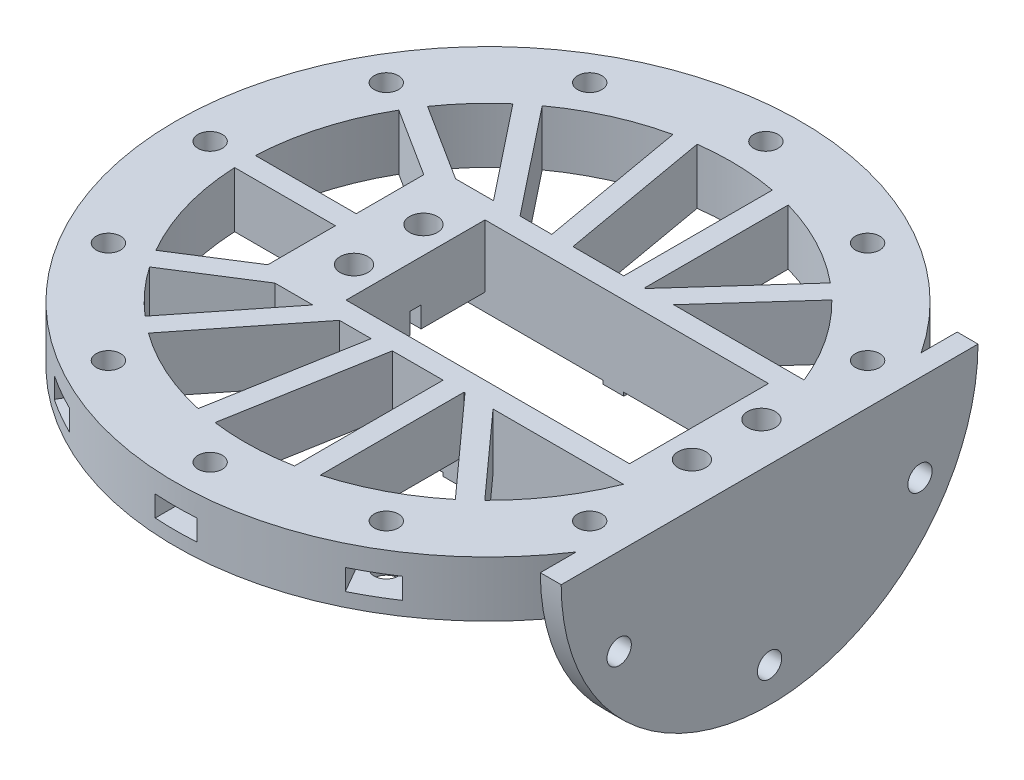
from build123d import *
from build123d.topology import SkipClean

# Parameters (mm, degrees)
SKETCH1_R                      = 45
BOSS_EXTRUDE1_DEPTH            = 12
SKETCH2_R                      = 35
CUT_EXTRUDE1_DEPTH             = 0.5
SKETCH3_W                      = 55
SKETCH3_H                      = 20
CUT_EXTRUDE2_DEPTH             = 2.5
CUT_EXTRUDE2_DIRECTION_2_REACH = 66.67
SKETCH4_W                      = 40.8
SKETCH4_H                      = 20
CUT_EXTRUDE3_DEPTH             = 9
BOSS_EXTRUDE2_DEPTH            = 0.5
SKETCH16_W                     = 7.160198966
SKETCH16_H                     = 1.6
SKETCH16_W_2                   = 7.039801034
CUT_EXTRUDE10_DEPTH            = 3
SKETCH27_R                     = 1.75
CUT_EXTRUDE15_DEPTH            = 65.761099435
CUT_EXTRUDE17_START            = -3
CUT_EXTRUDE17_DEPTH            = 3
SKETCH32_R                     = 2
CUT_EXTRUDE21_DEPTH            = 65.272855857
CUT_EXTRUDE22_DEPTH            = 12
SKETCH33_W                     = 9.501658327
SKETCH33_H                     = 76.019440946
CUT_EXTRUDE24_DEPTH            = 65.761099435
BOSS_EXTRUDE3_DEPTH            = 3
SKETCH35_W                     = 37
SKETCH35_H                     = 4
CUT_EXTRUDE26_DEPTH            = 90
CUT_EXTRUDE27_DEPTH            = 67.136223055
CUT_EXTRUDE27_DEPTH_BACK       = 67.136223055
CUT_EXTRUDE28_REACH            = 100.31
SKETCH37_R                     = 1.75


with BuildPart() as part:
    # Sketch1 → Boss-Extrude1 (new body)
    with BuildSketch(Plane(origin=(0, 0, 0), x_dir=(1, 0, 0), z_dir=(0, 1, 0))):
        with Locations(Location((0, 0, 0), (0, 0, 270))):
            Circle(SKETCH1_R)
    extrude(amount=BOSS_EXTRUDE1_DEPTH)

    # Sketch2 → Cut-Extrude1 (cut)
    with BuildSketch(Plane.XZ):
        with Locations(Location((0, 0, 0), (0, 0, 270))):
            Circle(SKETCH2_R)
    extrude(amount=-CUT_EXTRUDE1_DEPTH, mode=Mode.SUBTRACT)

    # Sketch3 → Cut-Extrude2 (cut)
    with BuildSketch(Plane.XZ.offset(-0.5)):
        with Locations((10.032407403, 0)):
            Rectangle(SKETCH3_W, SKETCH3_H)
    extrude(amount=-CUT_EXTRUDE2_DEPTH, mode=Mode.SUBTRACT)

    # Sketch3 → Cut-Extrude2 direction 2 (cut, up to next)
    with BuildSketch(Plane.XZ.offset(-0.5), mode=Mode.PRIVATE) as cut_extrude2_direction_2_sk1:
        with Locations((10.032407403, 0)):
            Rectangle(SKETCH3_W, SKETCH3_H)
    cut_extrude2_direction_2_tool1 = extrude(cut_extrude2_direction_2_sk1.sketch, amount=CUT_EXTRUDE2_DIRECTION_2_REACH, mode=Mode.PRIVATE) & part.part
    add(cut_extrude2_direction_2_tool1.solids().sort_by_distance((10.032407, 0.5, 0))[0], mode=Mode.SUBTRACT)

    # Sketch4 → Cut-Extrude3 (cut)
    with BuildSketch(Plane.XZ.offset(-3)):
        with Locations((9.972208437, 0)):
            Rectangle(SKETCH4_W, SKETCH4_H)
    extrude(amount=-CUT_EXTRUDE3_DEPTH, mode=Mode.SUBTRACT)

    # Sketch8 → Boss-Extrude2 (add, through all)
    with BuildSketch(Plane.XZ.offset(-0.5)):
        with BuildLine():
            Line((6.536713533, 10), (6.536713533, 34.384173339))
            ThreePointArc((6.536713533, 34.384173339), (8.317046002, 35.216938381), (9.536713533, 33.675675123))
            Line((9.536713533, 33.675675123), (9.536713533, 10))
            Line((9.536713533, 10), (6.536713533, 10))
        make_face()
        with BuildLine():
            Line((9.536713533, -10), (6.536713533, -10))
            Line((6.536713533, -10), (6.536713533, -34.384173339))
            ThreePointArc((6.536713533, -34.384173339), (8.317046002, -35.216938381), (9.536713533, -33.675675123))
            Line((9.536713533, -33.675675123), (9.536713533, -10))
        make_face()
        with BuildLine():
            Line((-17.467592597, 1.5), (-34.96784237, 1.5))
            ThreePointArc((-34.96784237, 1.5), (-36.46784237, 0), (-34.96784237, -1.5))
            Line((-34.96784237, -1.5), (-17.467592597, -1.5))
            Line((-17.467592597, -1.5), (-17.467592597, 1.5))
        make_face()
    extrude(amount=BOSS_EXTRUDE2_DEPTH)

    # Sketch16 → Cut-Extrude10 (cut)
    with BuildSketch(Plane.XZ.offset(-3)):
        with Locations((33.95230792, 0)):
            Rectangle(SKETCH16_W, SKETCH16_H)
        with Locations((-13.94769208, 0)):
            Rectangle(SKETCH16_W_2, SKETCH16_H)
    extrude(amount=-CUT_EXTRUDE10_DEPTH, mode=Mode.SUBTRACT)

    # Sketch27 → Cut-Extrude15 (cut, through all)
    with BuildSketch(Plane.XZ):
        with Locations(Location((34.641016151, -20, 0), (0, 0, 270))):
            Circle(SKETCH27_R)
        with Locations(Location((20, -34.641016151, 0), (0, 0, 270))):
            Circle(SKETCH27_R)
        with Locations(Location((0, -40, 0), (0, 0, 270))):
            Circle(SKETCH27_R)
        with Locations(Location((-20, -34.641016151, 0), (0, 0, 270))):
            Circle(SKETCH27_R)
        with Locations(Location((-34.641016151, -20, 0), (0, 0, 270))):
            Circle(SKETCH27_R)
        with Locations(Location((-40, 0, 0), (0, 0, 270))):
            Circle(SKETCH27_R)
        with Locations(Location((-34.641016151, 20, 0), (0, 0, 270))):
            Circle(SKETCH27_R)
        with Locations(Location((-20, 34.641016151, 0), (0, 0, 270))):
            Circle(SKETCH27_R)
        with Locations(Location((0, 40, 0), (0, 0, 270))):
            Circle(SKETCH27_R)
        with Locations(Location((20, 34.641016151, 0), (0, 0, 270))):
            Circle(SKETCH27_R)
        with Locations(Location((34.641016151, 20, 0), (0, 0, 270))):
            Circle(SKETCH27_R)
    extrude(amount=-CUT_EXTRUDE15_DEPTH, mode=Mode.SUBTRACT)

    # Sketch28 → Cut-Extrude17 (cut)
    with BuildSketch(Plane(origin=(0, 9, 0), x_dir=(1, 0, 0), z_dir=(0, 1, 0)).offset(CUT_EXTRUDE17_START)):
        with BuildLine():
            Line((-31.641016151, 18.267949192), (-31.641016151, 21.732050808))
            Line((-31.641016151, 21.732050808), (-37.38444419, 25.048020532))
            ThreePointArc((-37.38444419, 25.048020532), (-38.97114317, 22.5), (-40.38444419, 19.851868109))
            Line((-40.38444419, 19.851868109), (-34.641016151, 16.535898385))
            Line((-34.641016151, 16.535898385), (-31.641016151, 18.267949192))
        make_face()
        with BuildLine():
            Line((-36.535898385, 0), (-38.267949192, 3))
            Line((-38.267949192, 3), (-44.899888641, 3))
            ThreePointArc((-44.899888641, 3), (-45, 0), (-44.899888641, -3))
            Line((-44.899888641, -3), (-38.267949192, -3))
            Line((-38.267949192, -3), (-36.535898385, 0))
        make_face()
        with BuildLine():
            Line((-18.267949192, 31.641016151), (-16.535898385, 34.641016151))
            Line((-16.535898385, 34.641016151), (-19.851868109, 40.38444419))
            ThreePointArc((-19.851868109, 40.38444419), (-22.5, 38.97114317), (-25.048020532, 37.38444419))
            Line((-25.048020532, 37.38444419), (-21.732050808, 31.641016151))
            Line((-21.732050808, 31.641016151), (-18.267949192, 31.641016151))
        make_face()
        with BuildLine():
            Line((0, 36.535898385), (3, 38.267949192))
            Line((3, 38.267949192), (3, 44.899888641))
            ThreePointArc((3, 44.899888641), (0, 45), (-3, 44.899888641))
            Line((-3, 44.899888641), (-3, 38.267949192))
            Line((-3, 38.267949192), (0, 36.535898385))
        make_face()
        with BuildLine():
            Line((18.267949192, 31.641016151), (21.732050808, 31.641016151))
            Line((21.732050808, 31.641016151), (25.048020532, 37.38444419))
            ThreePointArc((25.048020532, 37.38444419), (22.5, 38.97114317), (19.851868109, 40.38444419))
            Line((19.851868109, 40.38444419), (16.535898385, 34.641016151))
            Line((16.535898385, 34.641016151), (18.267949192, 31.641016151))
        make_face()
        with BuildLine():
            Line((31.641016151, 18.267949192), (34.641016151, 16.535898385))
            Line((34.641016151, 16.535898385), (40.38444419, 19.851868109))
            ThreePointArc((40.38444419, 19.851868109), (38.97114317, 22.5), (37.38444419, 25.048020532))
            Line((37.38444419, 25.048020532), (31.641016151, 21.732050808))
            Line((31.641016151, 21.732050808), (31.641016151, 18.267949192))
        make_face()
        with BuildLine():
            Line((31.641016151, -18.267949192), (31.641016151, -21.732050808))
            Line((31.641016151, -21.732050808), (37.38444419, -25.048020532))
            ThreePointArc((37.38444419, -25.048020532), (38.97114317, -22.5), (40.38444419, -19.851868109))
            Line((40.38444419, -19.851868109), (34.641016151, -16.535898385))
            Line((34.641016151, -16.535898385), (31.641016151, -18.267949192))
        make_face()
        with BuildLine():
            Line((18.267949192, -31.641016151), (16.535898385, -34.641016151))
            Line((16.535898385, -34.641016151), (19.851868109, -40.38444419))
            ThreePointArc((19.851868109, -40.38444419), (22.5, -38.97114317), (25.048020532, -37.38444419))
            Line((25.048020532, -37.38444419), (21.732050808, -31.641016151))
            Line((21.732050808, -31.641016151), (18.267949192, -31.641016151))
        make_face()
        with BuildLine():
            Line((0, -36.535898385), (-3, -38.267949192))
            Line((-3, -38.267949192), (-3, -44.899888641))
            ThreePointArc((-3, -44.899888641), (0, -45), (3, -44.899888641))
            Line((3, -44.899888641), (3, -38.267949192))
            Line((3, -38.267949192), (0, -36.535898385))
        make_face()
        with BuildLine():
            Line((-18.267949192, -31.641016151), (-21.732050808, -31.641016151))
            Line((-21.732050808, -31.641016151), (-25.048020532, -37.38444419))
            ThreePointArc((-25.048020532, -37.38444419), (-22.5, -38.97114317), (-19.851868109, -40.38444419))
            Line((-19.851868109, -40.38444419), (-16.535898385, -34.641016151))
            Line((-16.535898385, -34.641016151), (-18.267949192, -31.641016151))
        make_face()
        with BuildLine():
            Line((-31.641016151, -18.267949192), (-34.641016151, -16.535898385))
            Line((-34.641016151, -16.535898385), (-40.38444419, -19.851868109))
            ThreePointArc((-40.38444419, -19.851868109), (-38.97114317, -22.5), (-37.38444419, -25.048020532))
            Line((-37.38444419, -25.048020532), (-31.641016151, -21.732050808))
            Line((-31.641016151, -21.732050808), (-31.641016151, -18.267949192))
        make_face()
    extrude(amount=CUT_EXTRUDE17_DEPTH, mode=Mode.SUBTRACT)

    # Sketch32 → Cut-Extrude21 (cut, through all)
    with BuildSketch(Plane.XZ.offset(-3)):
        with Locations(Location((-14.287592597, -5, 0), (0, 0, 270))):
            Circle(SKETCH32_R)
        with Locations(Location((-14.287592597, 5, 0), (0, 0, 90))):
            Circle(SKETCH32_R)
        with Locations(Location((34.352407403, -5, 0), (0, 0, 90))):
            Circle(SKETCH32_R)
        with Locations(Location((34.352407403, 5, 0), (0, 0, 270))):
            Circle(SKETCH32_R)
    extrude(amount=-CUT_EXTRUDE21_DEPTH, mode=Mode.SUBTRACT)

    # Sketch29 → Cut-Extrude22 (cut)
    with BuildSketch(Plane.XZ.offset(-0.5)):
        with BuildLine():
            Line((-20.467592597, 11.223012065), (-30.32145066, 17.481694136))
            ThreePointArc((-30.32145066, 17.481694136), (-33.608430236, 9.771049946), (-34.96784237, 1.5))
            Line((-34.96784237, 1.5), (-20.467592597, 1.5))
            Line((-20.467592597, 1.5), (-20.467592597, 11.223012065))
        make_face()
        with BuildLine():
            ThreePointArc((-34.96784237, -1.5), (-33.608430236, -9.771049946), (-30.32145066, -17.481694136))
            Line((-30.32145066, -17.481694136), (-20.467592597, -11.223012065))
            Line((-20.467592597, -11.223012065), (-20.467592597, -1.5))
            Line((-20.467592597, -1.5), (-34.96784237, -1.5))
        make_face()
        with BuildLine():
            ThreePointArc((-28.713011556, -20.014069236), (-26.003567366, -23.426789883), (-22.891062575, -26.476390506))
            Line((-22.891062575, -26.476390506), (-12.21368146, -13))
            Line((-12.21368146, -13), (-17.669849128, -13))
            Line((-17.669849128, -13), (-28.713011556, -20.014069236))
        make_face()
        with BuildLine():
            ThreePointArc((-20.539653162, -28.339418625), (-14.344487277, -31.925470784), (-7.549313734, -34.176130005))
            Line((-7.549313734, -34.176130005), (-3.815390667, -13))
            Line((-3.815390667, -13), (-8.386189764, -13))
            Line((-8.386189764, -13), (-20.539653162, -28.339418625))
        make_face()
        with BuildLine():
            Line((6.536713533, -34.384173339), (6.536713533, -13))
            Line((6.536713533, -13), (-0.769110831, -13))
            Line((-0.769110831, -13), (-4.594890475, -34.697074538))
            ThreePointArc((-4.594890475, -34.697074538), (0.983435807, -34.986180901), (6.536713533, -34.384173339))
        make_face()
        with BuildLine():
            Line((9.536713533, -13), (9.536713533, -33.675675123))
            ThreePointArc((9.536713533, -33.675675123), (16.258507894, -30.994530502), (22.285220439, -26.988311359))
            Line((22.285220439, -26.988311359), (9.688319988, -13))
            Line((9.688319988, -13), (9.536713533, -13))
        make_face()
        with BuildLine():
            Line((13.725471951, -13), (24.514514774, -24.980763908))
            ThreePointArc((24.514514774, -24.980763908), (29.127972013, -19.40518607), (32.496153619, -13))
            Line((32.496153619, -13), (13.725471951, -13))
        make_face()
        with BuildLine():
            Line((32.496153619, 13), (13.725471951, 13))
            Line((13.725471951, 13), (24.514514774, 24.980763908))
            ThreePointArc((24.514514774, 24.980763908), (29.127972013, 19.40518607), (32.496153619, 13))
        make_face()
        with BuildLine():
            Line((9.688319988, 13), (22.285220439, 26.988311359))
            ThreePointArc((22.285220439, 26.988311359), (16.258507894, 30.994530502), (9.536713533, 33.675675123))
            Line((9.536713533, 33.675675123), (9.536713533, 13))
            Line((9.536713533, 13), (9.688319988, 13))
        make_face()
        with BuildLine():
            Line((6.536713533, 13), (6.536713533, 34.384173339))
            ThreePointArc((6.536713533, 34.384173339), (0.983435807, 34.986180901), (-4.594890475, 34.697074538))
            Line((-4.594890475, 34.697074538), (-0.769110831, 13))
            Line((-0.769110831, 13), (6.536713533, 13))
        make_face()
        with BuildLine():
            Line((-7.549313734, 34.176130005), (-3.815390667, 13))
            Line((-3.815390667, 13), (-8.386189764, 13))
            Line((-8.386189764, 13), (-20.539653162, 28.339418625))
            ThreePointArc((-20.539653162, 28.339418625), (-14.344487277, 31.925470784), (-7.549313734, 34.176130005))
        make_face()
        with BuildLine():
            Line((-22.891062575, 26.476390506), (-12.21368146, 13))
            Line((-12.21368146, 13), (-17.669849128, 13))
            Line((-17.669849128, 13), (-28.713011556, 20.014069236))
            ThreePointArc((-28.713011556, 20.014069236), (-26.003567366, 23.426789883), (-22.891062575, 26.476390506))
        make_face()
    extrude(amount=-CUT_EXTRUDE22_DEPTH, mode=Mode.SUBTRACT)

    # Sketch33 → Cut-Extrude24 (cut, through all)
    with SkipClean():  # the faces are left unmerged after this step: merging them gives an invalid solid
        with BuildSketch(Plane.XZ):
            with Locations((42.283236567, 0.770857297)):
                Rectangle(SKETCH33_W, SKETCH33_H)
        extrude(amount=-CUT_EXTRUDE24_DEPTH, mode=Mode.SUBTRACT)

    # Sketch34 → Boss-Extrude3 (add)
    with SkipClean():  # the faces are left unmerged after this step: merging them gives an invalid solid
        with BuildSketch(Plane(origin=(37.532407403, 0, 0), x_dir=(0, 0, -1), z_dir=(1, 0, 0))):
            with BuildLine():
                Line((30, 12), (-30, 12))
                ThreePointArc((-30, 12), (0, -18), (30, 12))
            make_face()
        extrude(amount=BOSS_EXTRUDE3_DEPTH)

    # Sketch35 → Cut-Extrude26 (cut)
    with BuildSketch(Plane.ZY.offset(-37.532407403)):
        with Locations((31.5, 2)):
            Rectangle(SKETCH35_W, SKETCH35_H)
        with Locations((-31.5, 2)):
            Rectangle(SKETCH35_W, SKETCH35_H)
    extrude(amount=CUT_EXTRUDE26_DEPTH, mode=Mode.SUBTRACT)

    # Sketch36 → Cut-Extrude27 (cut, two sides: drawn at the far end of the back side and taken through both)
    with BuildSketch(Plane.XY.offset(-CUT_EXTRUDE27_DEPTH_BACK)):
        Polygon((-17.467592597, 0), (-17.467592597, 0.5), (-20.467592597, 0.5), (-23.265336067, 4), (-47.496153619, 4), (-47.496153619, 0), align=None)
    extrude(amount=CUT_EXTRUDE27_DEPTH + CUT_EXTRUDE27_DEPTH_BACK, mode=Mode.SUBTRACT)

    # Sketch37 → Cut-Extrude28 (cut, up to next)
    with BuildSketch(Plane(origin=(40.532407403, 0, 0), x_dir=(0, 0, -1), z_dir=(1, 0, 0)), mode=Mode.PRIVATE) as cut_extrude28_sk1:
        with Locations((0, -13)):
            Circle(SKETCH37_R)
    cut_extrude28_tool1 = extrude(cut_extrude28_sk1.sketch, amount=-CUT_EXTRUDE28_REACH, mode=Mode.PRIVATE) & part.part
    # Sketch37 → Cut-Extrude28 (cut, up to next)
    with BuildSketch(Plane(origin=(40.532407403, 0, 0), x_dir=(0, 0, -1), z_dir=(1, 0, 0)), mode=Mode.PRIVATE) as cut_extrude28_sk2:
        with Locations((-21.650635095, -0.5)):
            Circle(SKETCH37_R)
    cut_extrude28_tool2 = extrude(cut_extrude28_sk2.sketch, amount=-CUT_EXTRUDE28_REACH, mode=Mode.PRIVATE) & part.part
    # Sketch37 → Cut-Extrude28 (cut, up to next)
    with BuildSketch(Plane(origin=(40.532407403, 0, 0), x_dir=(0, 0, -1), z_dir=(1, 0, 0)), mode=Mode.PRIVATE) as cut_extrude28_sk3:
        with Locations((21.650635095, -0.5)):
            Circle(SKETCH37_R)
    cut_extrude28_tool3 = extrude(cut_extrude28_sk3.sketch, amount=-CUT_EXTRUDE28_REACH, mode=Mode.PRIVATE) & part.part
    add(cut_extrude28_tool1.solids().sort_by_distance((40.532407, -13, 0))[0], mode=Mode.SUBTRACT)
    add(cut_extrude28_tool2.solids().sort_by_distance((40.532407, -0.5, 21.650635))[0], mode=Mode.SUBTRACT)
    add(cut_extrude28_tool3.solids().sort_by_distance((40.532407, -0.5, -21.650635))[0], mode=Mode.SUBTRACT)


solid = part.part
